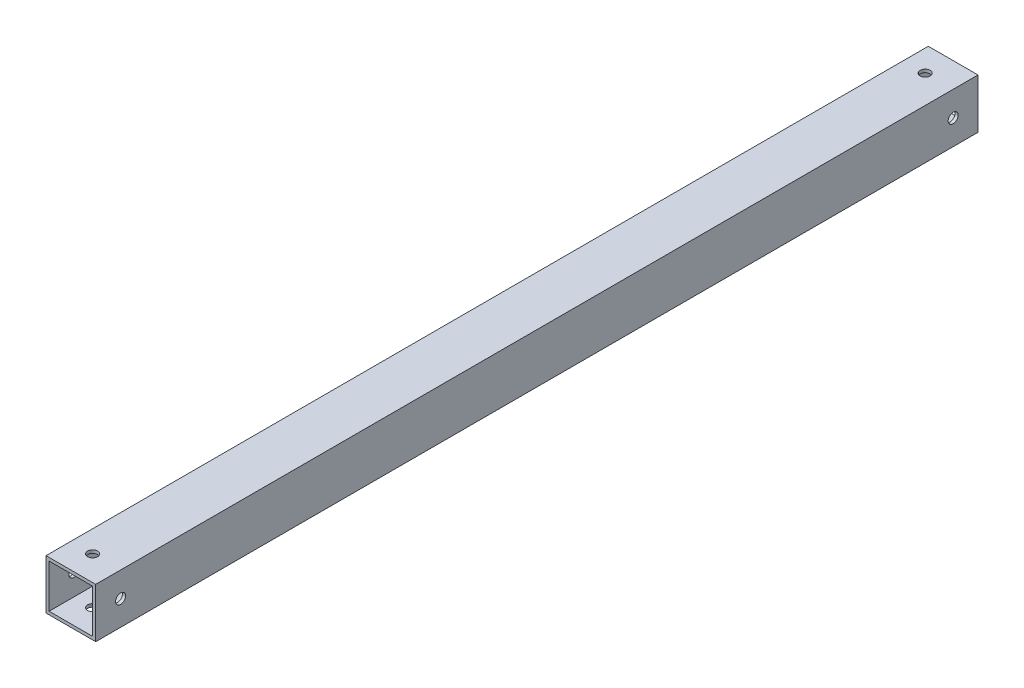
from build123d import *

# Parameters (mm, degrees)
SKETCH1_W           = 25.4
SKETCH1_H           = 25.4
SKETCH1_W_2         = 22.225
SKETCH1_H_2         = 22.225
BOSS_EXTRUDE1_DEPTH = 450.85
SKETCH4_R           = 2.54
CUT_EXTRUDE3_DEPTH  = 453.278722139
SKETCH5_R           = 2.54
CUT_EXTRUDE4_DEPTH  = 453.278722139


with BuildPart() as part:
    # Sketch1 → Boss-Extrude1 (new body)
    with BuildSketch(Plane.XY):
        with Locations((12.7, 12.7)):
            Rectangle(SKETCH1_W, SKETCH1_H)
        with Locations((12.7, 12.7)):
            Rectangle(SKETCH1_W_2, SKETCH1_H_2, mode=Mode.SUBTRACT)
    extrude(amount=BOSS_EXTRUDE1_DEPTH)

    # Sketch4 → Cut-Extrude3 (cut, through all)
    with BuildSketch(Plane(origin=(25.4, 0, 0), x_dir=(0, 0, -1), z_dir=(1, 0, 0))):
        with Locations((-438.15, 12.7)):
            Circle(SKETCH4_R)
        with Locations(Location((-12.7, 12.7, 0), (0, 0, 180))):
            Circle(SKETCH4_R)
    extrude(amount=-CUT_EXTRUDE3_DEPTH, mode=Mode.SUBTRACT)

    # Sketch5 → Cut-Extrude4 (cut, through all)
    with BuildSketch(Plane.XZ):
        with Locations(Location((11.1125, 438.15, 0), (0, 0, 270))):
            Circle(SKETCH5_R)
        with Locations(Location((11.1125, 12.7, 0), (0, 0, 270))):
            Circle(SKETCH5_R)
    extrude(amount=-CUT_EXTRUDE4_DEPTH, mode=Mode.SUBTRACT)


solid = part.part
